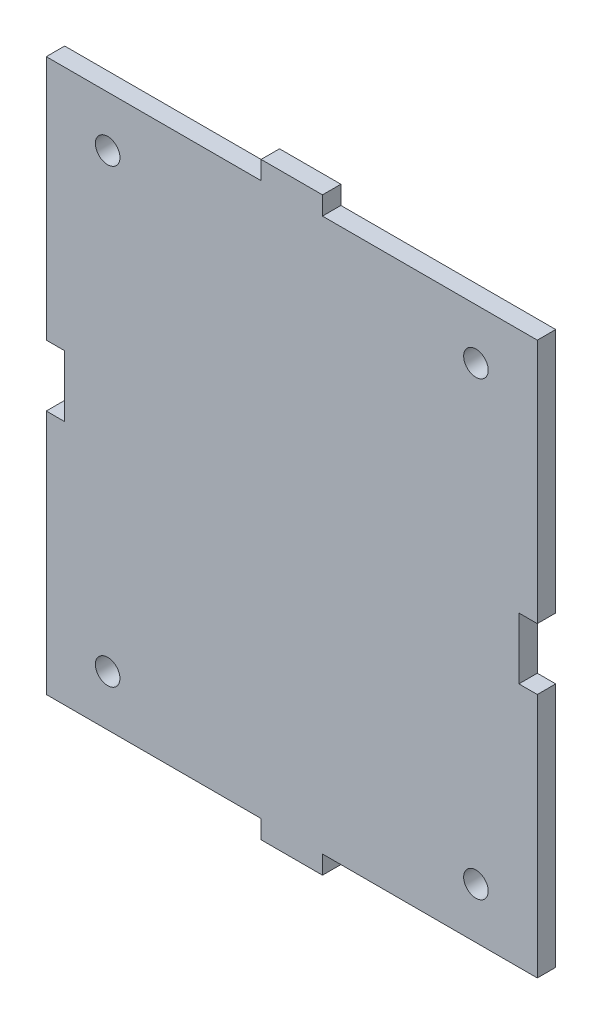
from build123d import *

# Parameters (mm, degrees)
SKETCH1_R           = 2
BOSS_EXTRUDE1_DEPTH = 3


with BuildPart() as part:
    # Sketch1 → Boss-Extrude1 (new body)
    with BuildSketch(Plane.XY):
        Polygon((5, 8.25), (40, 8.25), (40, -31.75), (37, -31.75), (37, -41.75), (40, -41.75), (40, -81.75), (5, -81.75), (5, -84.75), (-5, -84.75), (-5, -81.75), (-40, -81.75), (-40, -41.75), (-37, -41.75), (-37, -31.75), (-40, -31.75), (-40, 8.25), (-5, 8.25), (-5, 11.25), (5, 11.25), align=None)
        with Locations((30, 0)):
            Circle(SKETCH1_R, mode=Mode.SUBTRACT)
        with Locations(Location((30, -73.5, 0), (0, 0, 180))):
            Circle(SKETCH1_R, mode=Mode.SUBTRACT)
        with Locations((-30, -73.5)):
            Circle(SKETCH1_R, mode=Mode.SUBTRACT)
        with Locations(Location((-30, 0, 0), (0, 0, 180))):
            Circle(SKETCH1_R, mode=Mode.SUBTRACT)
    extrude(amount=BOSS_EXTRUDE1_DEPTH)


solid = part.part
